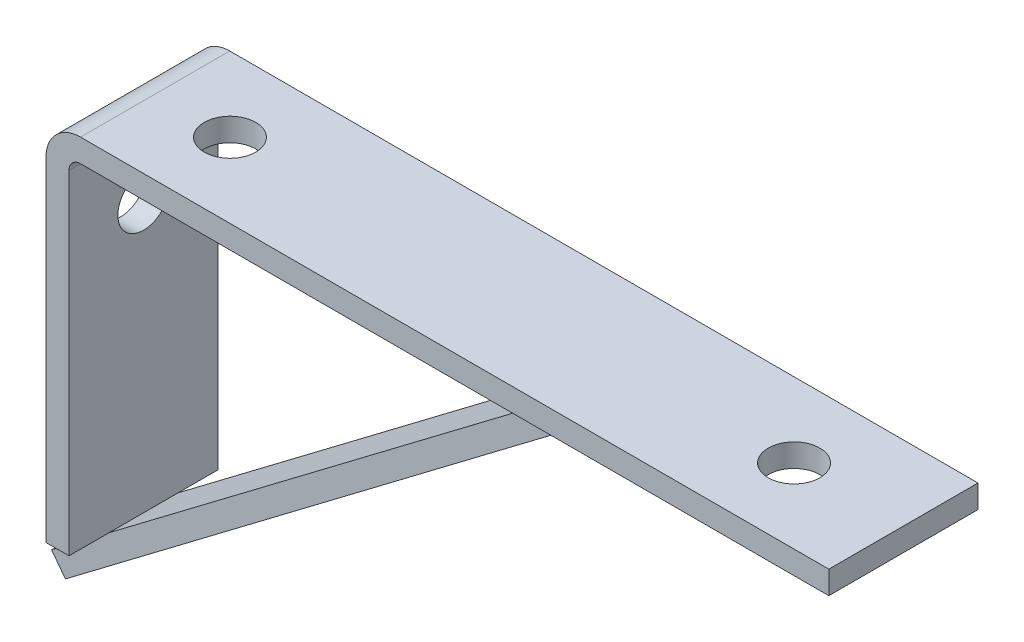
from build123d import *

# Parameters (mm, degrees)
EXTRUDE_THIN1_DEPTH = 20.574
BOSS_EXTRUDE1_DEPTH = 9.525
SKETCH3_R           = 7.112
CUT_EXTRUDE1_DEPTH  = 6.35
SKETCH4_R           = 7.112
CUT_EXTRUDE2_DEPTH  = 6.35


with BuildPart() as part:
    # Sketch1 → Extrude-Thin1 (new, symmetric)
    with BuildSketch(Plane.XY):
        with BuildLine():
            Line((-112.7125, -101.6), (-112.7125, -9.525))
            ThreePointArc((-112.7125, -9.525), (-109.922692091, -2.789807909), (-103.1875, 0))
            Line((-103.1875, 0), (103.1875, 0))
            Line((103.1875, 0), (103.1875, -6.35))
            Line((103.1875, -6.35), (-103.1875, -6.35))
            ThreePointArc((-103.1875, -6.35), (-105.43256403, -7.27993597), (-106.3625, -9.525))
            Line((-106.3625, -9.525), (-106.3625, -101.6))
            Line((-106.3625, -101.6), (-112.7125, -101.6))
        make_face()
    extrude(amount=EXTRUDE_THIN1_DEPTH, both=True)

    # Sketch2 → Boss-Extrude1 (add, symmetric)
    with BuildSketch(Plane.XY):
        Polygon((19.567609966, -6.35), (-106.3625, -101.6), (-112.7125, -101.6), (-112.7125, -106.402961739), (-122.2375, -113.607404348), (-118.406878416, -118.671872561), (30.093969492, -6.35), align=None)
    extrude(amount=BOSS_EXTRUDE1_DEPTH, both=True)

    # Sketch3 → Cut-Extrude1 (cut)
    with BuildSketch(Plane(origin=(0, 0, 0), x_dir=(1, 0, 0), z_dir=(0, 1, 0))):
        with Locations(Location((-82.55, 0, 0), (0, 0, 180))):
            Circle(SKETCH3_R)
        with Locations(Location((73.025, 0, 0), (0, 0, 180))):
            Circle(SKETCH3_R)
    extrude(amount=-CUT_EXTRUDE1_DEPTH, mode=Mode.SUBTRACT)

    # Sketch4 → Cut-Extrude2 (cut)
    with BuildSketch(Plane.ZY.offset(112.7125)):
        with Locations((0, -26.9875)):
            Circle(SKETCH4_R)
    extrude(amount=-CUT_EXTRUDE2_DEPTH, mode=Mode.SUBTRACT)


solid = part.part
